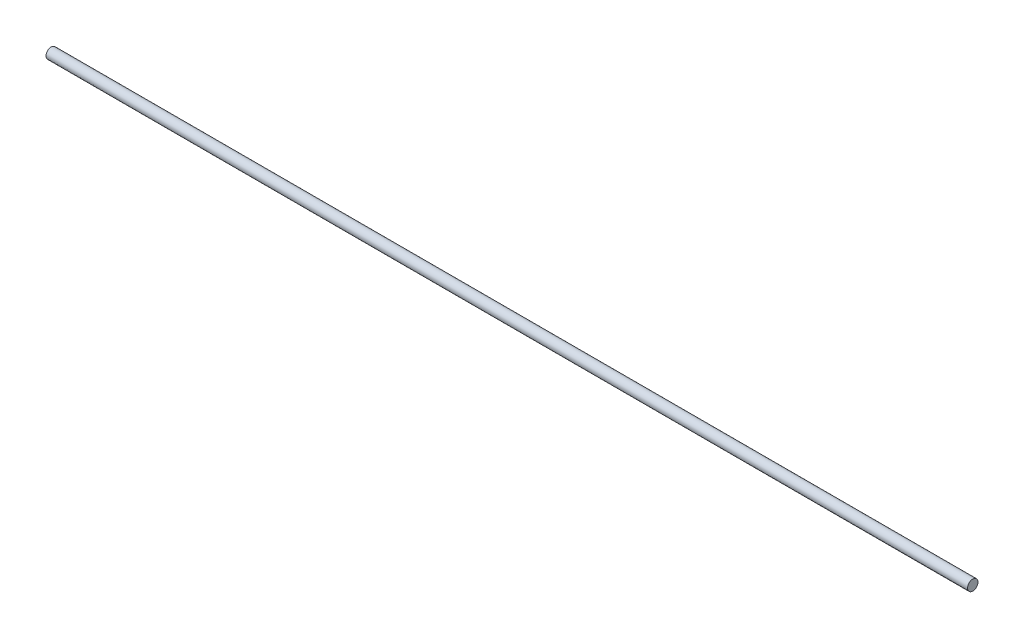
from build123d import *

# Parameters (mm, degrees)
SKETCH1_R           = 6.35
BOSS_EXTRUDE1_DEPTH = 1122.137625954


with BuildPart() as part:
    # Sketch1 → Boss-Extrude1 (new body)
    with BuildSketch(Plane.YZ):
        with Locations(Location((0, 0, 0), (0, 0, 270))):
            Circle(SKETCH1_R)
    extrude(amount=-BOSS_EXTRUDE1_DEPTH)


solid = part.part
